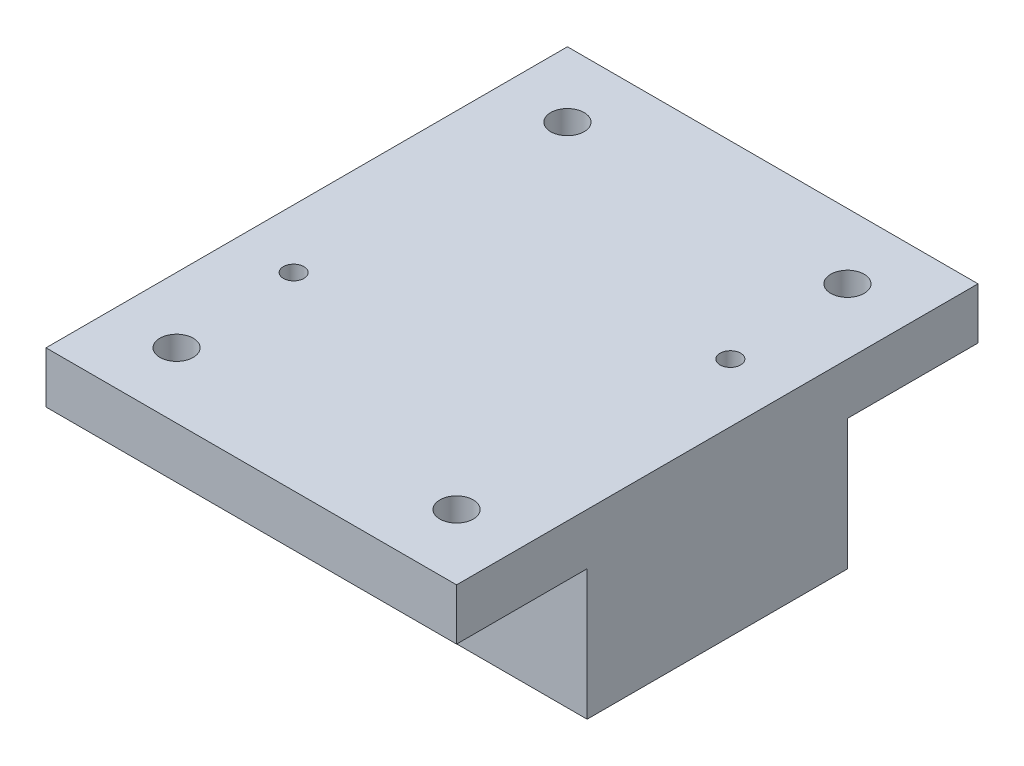
from build123d import *

# Parameters (mm, degrees)
SKETCH1_W           = 80
SKETCH1_H           = 101.6
SKETCH1_R           = 3.25
BOSS_EXTRUDE1_DEPTH = 10
SKETCH1_3_W         = 80
SKETCH1_3_H         = 50.725
BOSS_EXTRUDE2_DEPTH = 25.4
SKETCH2_R           = 2
CUT_EXTRUDE1_DEPTH  = 74.7143134


with BuildPart() as part:
    # Sketch1 → Boss-Extrude1 (new body)
    with BuildSketch(Plane(origin=(0, 0, 0), x_dir=(1, 0, 0), z_dir=(0, 1, 0))):
        Rectangle(SKETCH1_W, SKETCH1_H)
        with Locations((27.28125, 38.08125)):
            Circle(SKETCH1_R, mode=Mode.SUBTRACT)
        with Locations((-27.28125, 38.08125)):
            Circle(SKETCH1_R, mode=Mode.SUBTRACT)
        with Locations((27.28125, -38.08125)):
            Circle(SKETCH1_R, mode=Mode.SUBTRACT)
        with Locations((-27.28125, -38.08125)):
            Circle(SKETCH1_R, mode=Mode.SUBTRACT)
    extrude(amount=BOSS_EXTRUDE1_DEPTH)

    # Sketch1<3> → Boss-Extrude2 (add)
    with BuildSketch(Plane(origin=(0, 0, 0), x_dir=(1, 0, 0), z_dir=(0, 1, 0))):
        Rectangle(SKETCH1_3_W, SKETCH1_3_H)
    extrude(amount=-BOSS_EXTRUDE2_DEPTH)

    # Sketch2 → Cut-Extrude1 (cut, through all)
    with BuildSketch(Plane(origin=(0, 10, 0), x_dir=(1, 0, 0), z_dir=(0, 1, 0))):
        with Locations((-28.575, -13.97)):
            Circle(SKETCH2_R)
        with Locations((28.575, 13.97)):
            Circle(SKETCH2_R)
    extrude(amount=-CUT_EXTRUDE1_DEPTH, mode=Mode.SUBTRACT)


solid = part.part
